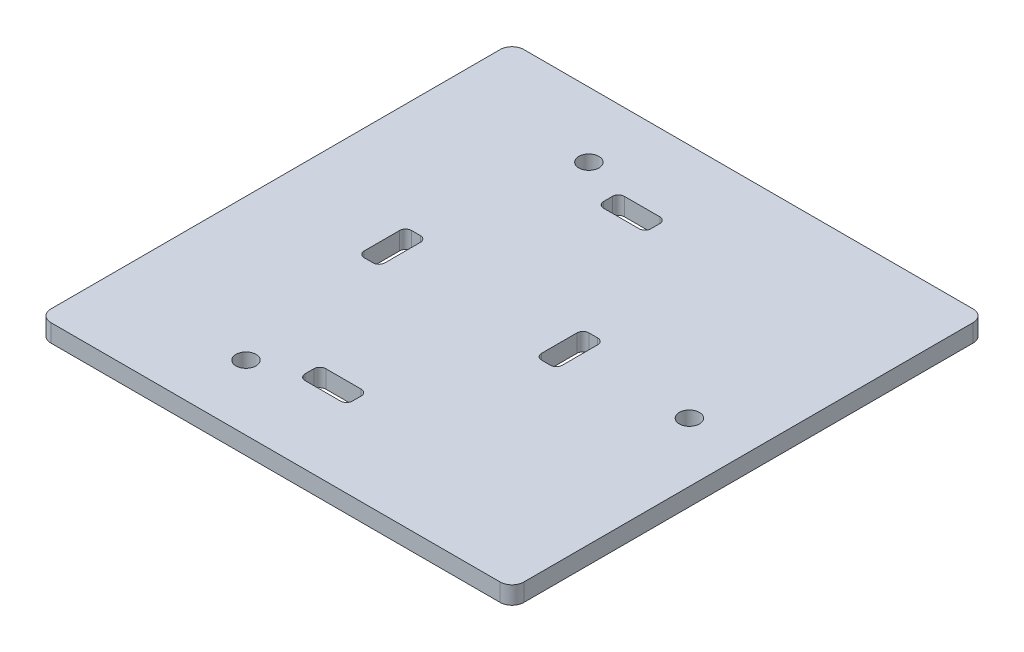
from build123d import *

# Parameters (mm, degrees)
SKETCH1_W           = 80
SKETCH1_H           = 80
BOSS_EXTRUDE1_DEPTH = 3
SKETCH5_R           = 1.7
SKETCH5_W           = 3.5
SKETCH5_H           = 8
SKETCH5_W_2         = 8
SKETCH5_H_2         = 3.5
CUT_EXTRUDE5_DEPTH  = 3
FILLET1_R           = 1
FILLET2_R           = 1
FILLET3_R           = 2


with BuildPart() as part:
    # Sketch1 → Boss-Extrude1 (new body)
    with BuildSketch(Plane(origin=(0, 0, 0), x_dir=(1, 0, 0), z_dir=(0, 1, 0))):
        Rectangle(SKETCH1_W, SKETCH1_H)
    extrude(amount=BOSS_EXTRUDE1_DEPTH)

    # Sketch5 → Cut-Extrude5 (cut)
    with BuildSketch(Plane(origin=(0, 0, 0), x_dir=(1, 0, 0), z_dir=(0, 1, 0))):
        with Locations(Location((30, 0, 0), (0, 0, 270))):
            Circle(SKETCH5_R)
        with Locations(Location((-16, 29, 0), (0, 0, 270))):
            Circle(SKETCH5_R)
        with Locations(Location((-16, -29, 0), (0, 0, 270))):
            Circle(SKETCH5_R)
        with Locations((9.75, 0)):
            Rectangle(SKETCH5_W, SKETCH5_H)
        with Locations((-20.25, 0)):
            Rectangle(SKETCH5_W, SKETCH5_H)
        with Locations((-5, 25.25)):
            Rectangle(SKETCH5_W_2, SKETCH5_H_2)
        with Locations((-5, -25.25)):
            Rectangle(SKETCH5_W_2, SKETCH5_H_2)
    extrude(amount=CUT_EXTRUDE5_DEPTH, mode=Mode.SUBTRACT)

    # Fillet1
    fillet1_edges = [part.edges().sort_by_distance(p)[0] for p in [
        (11.5, 1.5, 4),
        (11.5, 1.5, -4),
        (8, 1.5, -4),
        (8, 1.5, 4),
    ]]
    fillet(fillet1_edges, radius=FILLET1_R)

    # Fillet2
    fillet2_edges = [part.edges().sort_by_distance(p)[0] for p in [
        (-1, 1.5, 27),
        (-1, 1.5, 23.5),
        (-9, 1.5, 23.5),
        (-9, 1.5, 27),
        (-1, 1.5, -23.5),
        (-1, 1.5, -27),
        (-9, 1.5, -27),
        (-9, 1.5, -23.5),
        (-18.5, 1.5, 4),
        (-18.5, 1.5, -4),
        (-22, 1.5, -4),
        (-22, 1.5, 4),
    ]]
    fillet(fillet2_edges, radius=FILLET2_R)

    # Fillet3
    fillet3_edges = [part.edges().sort_by_distance(p)[0] for p in [
        (40, 1.5, 40),
        (-40, 1.5, 40),
        (-40, 1.5, -40),
        (40, 1.5, -40),
    ]]
    fillet(fillet3_edges, radius=FILLET3_R)


solid = part.part
